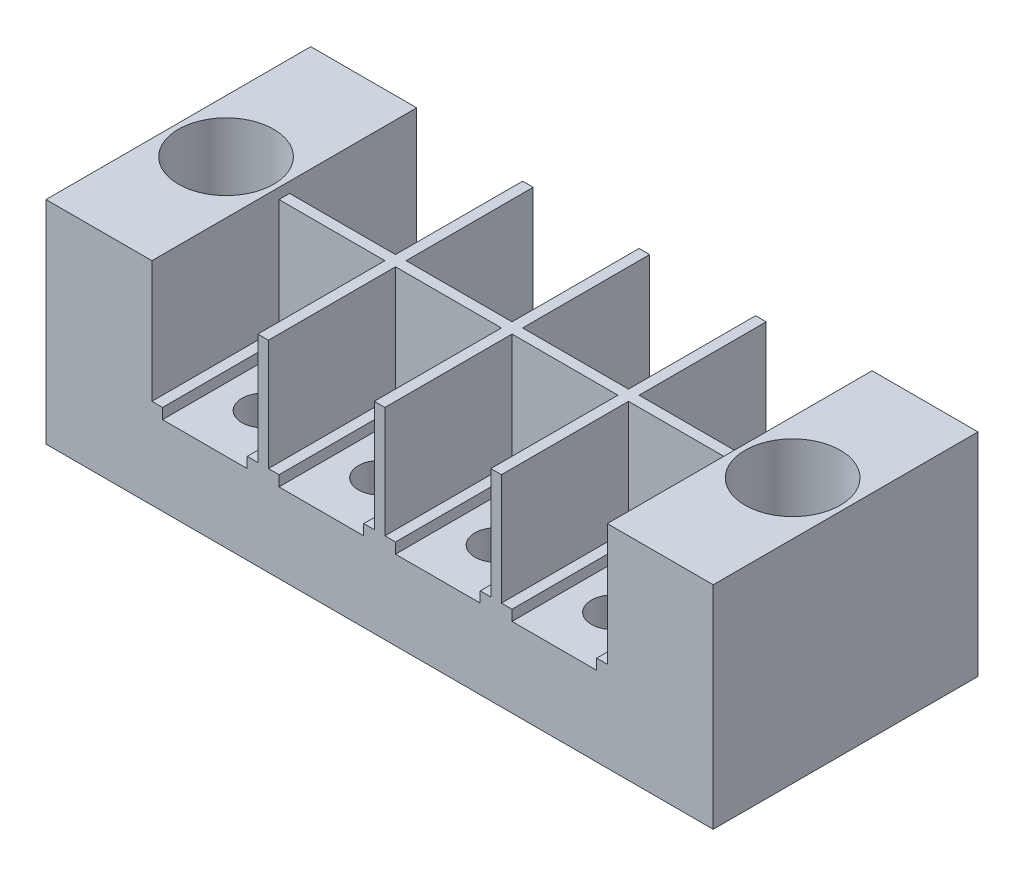
from build123d import *

# Parameters (mm, degrees)
SKETCH2_W           = 63
SKETCH2_H           = 25
BOSS_EXTRUDE2_DEPTH = 20
SKETCH5_W           = 43
SKETCH5_H           = 25
CUT_EXTRUDE2_DEPTH  = 1
SKETCH6_W           = 10
SKETCH6_H           = 12
CUT_EXTRUDE3_DEPTH  = 10
CUT_EXTRUDE4_DEPTH  = 24
SKETCH8_W           = 43
SKETCH8_H           = 3
CUT_EXTRUDE5_DEPTH  = 8
SKETCH9_R           = 2
CUT_EXTRUDE6_DEPTH  = 4
SKETCH10_R          = 4.5
CUT_EXTRUDE7_DEPTH  = 19
SKETCH11_R          = 2
CUT_EXTRUDE8_DEPTH  = 19


with BuildPart() as part:
    # Sketch2 → Boss-Extrude2 (new body)
    with BuildSketch(Plane(origin=(0, 0, 0), x_dir=(1, 0, 0), z_dir=(0, 1, 0))):
        Rectangle(SKETCH2_W, SKETCH2_H)
    extrude(amount=BOSS_EXTRUDE2_DEPTH)

    # Sketch5 → Cut-Extrude2 (cut)
    with BuildSketch(Plane(origin=(0, 20, 0), x_dir=(1, 0, 0), z_dir=(0, 1, 0))):
        Rectangle(SKETCH5_W, SKETCH5_H)
    extrude(amount=-CUT_EXTRUDE2_DEPTH, mode=Mode.SUBTRACT)

    # Sketch6 → Cut-Extrude3 (cut)
    with BuildSketch(Plane(origin=(0, 19, 0), x_dir=(1, 0, 0), z_dir=(0, 1, 0))):
        with Locations((-16.5, 6.5)):
            Rectangle(SKETCH6_W, SKETCH6_H)
        with Locations((-16.5, -6.5)):
            Rectangle(SKETCH6_W, SKETCH6_H)
        with Locations((-5.5, -6.5)):
            Rectangle(SKETCH6_W, SKETCH6_H)
        with Locations((-5.5, 6.5)):
            Rectangle(SKETCH6_W, SKETCH6_H)
        with Locations((5.5, 6.5)):
            Rectangle(SKETCH6_W, SKETCH6_H)
        with Locations((5.5, -6.5)):
            Rectangle(SKETCH6_W, SKETCH6_H)
        with Locations((16.5, -6.5)):
            Rectangle(SKETCH6_W, SKETCH6_H)
        with Locations((16.5, 6.5)):
            Rectangle(SKETCH6_W, SKETCH6_H)
    extrude(amount=-CUT_EXTRUDE3_DEPTH, mode=Mode.SUBTRACT)

    # Sketch7 → Cut-Extrude4 (cut)
    with BuildSketch(Plane.XY.offset(12.5)):
        Polygon((-21.5, 9), (-11.5, 9), (-11.5, 8.5), (-12.5, 8.5), (-12.5, 7.5), (-20.5, 7.5), (-20.5, 8.5), (-21.5, 8.5), align=None)
        Polygon((-10.5, 9), (-0.5, 9), (-0.5, 8.5), (-1.5, 8.5), (-1.5, 7.5), (-9.5, 7.5), (-9.5, 8.5), (-10.5, 8.5), align=None)
        Polygon((0.5, 9), (10.5, 9), (10.5, 8.5), (9.5, 8.5), (9.5, 7.5), (1.5, 7.5), (1.5, 8.5), (0.5, 8.5), align=None)
        Polygon((11.5, 9), (21.5, 9), (21.5, 8.5), (20.5, 8.5), (20.5, 7.5), (12.5, 7.5), (12.5, 8.5), (11.5, 8.5), align=None)
    extrude(amount=-CUT_EXTRUDE4_DEPTH, mode=Mode.SUBTRACT)

    # Sketch8 → Cut-Extrude5 (cut)
    with BuildSketch(Plane.XZ):
        Rectangle(SKETCH8_W, SKETCH8_H)
    extrude(amount=-CUT_EXTRUDE5_DEPTH, mode=Mode.SUBTRACT)

    # Sketch9 → Cut-Extrude6 (cut)
    with BuildSketch(Plane(origin=(0, 7.5, 0), x_dir=(1, 0, 0), z_dir=(0, 1, 0))):
        with Locations(Location((-16.5, -7, 0), (0, 0, 270))):
            Circle(SKETCH9_R)
        with Locations(Location((-5.5, -7, 0), (0, 0, 270))):
            Circle(SKETCH9_R)
        with Locations(Location((5.5, -7, 0), (0, 0, 270))):
            Circle(SKETCH9_R)
        with Locations(Location((16.5, -7, 0), (0, 0, 270))):
            Circle(SKETCH9_R)
        with Locations(Location((16.5, 7, 0), (0, 0, 90))):
            Circle(SKETCH9_R)
        with Locations(Location((5.5, 7, 0), (0, 0, 90))):
            Circle(SKETCH9_R)
        with Locations(Location((-5.5, 7, 0), (0, 0, 90))):
            Circle(SKETCH9_R)
        with Locations(Location((-16.5, 7, 0), (0, 0, 90))):
            Circle(SKETCH9_R)
    extrude(amount=-CUT_EXTRUDE6_DEPTH, mode=Mode.SUBTRACT)

    # Sketch10 → Cut-Extrude7 (cut)
    with BuildSketch(Plane(origin=(0, 20, 0), x_dir=(1, 0, 0), z_dir=(0, 1, 0))):
        with Locations(Location((26.5, 0, 0), (0, 0, 270))):
            Circle(SKETCH10_R)
        with Locations(Location((-26.5, -0.5, 0), (0, 0, 270))):
            Circle(SKETCH10_R)
    extrude(amount=-CUT_EXTRUDE7_DEPTH, mode=Mode.SUBTRACT)

    # Sketch11 → Cut-Extrude8 (cut)
    with BuildSketch(Plane(origin=(0, 1, 0), x_dir=(1, 0, 0), z_dir=(0, 1, 0))):
        with Locations(Location((-26.5, -0.5, 0), (0, 0, 270))):
            Circle(SKETCH11_R)
        with Locations(Location((26.5, 0, 0), (0, 0, 270))):
            Circle(SKETCH11_R)
    extrude(amount=-CUT_EXTRUDE8_DEPTH, mode=Mode.SUBTRACT)


solid = part.part
